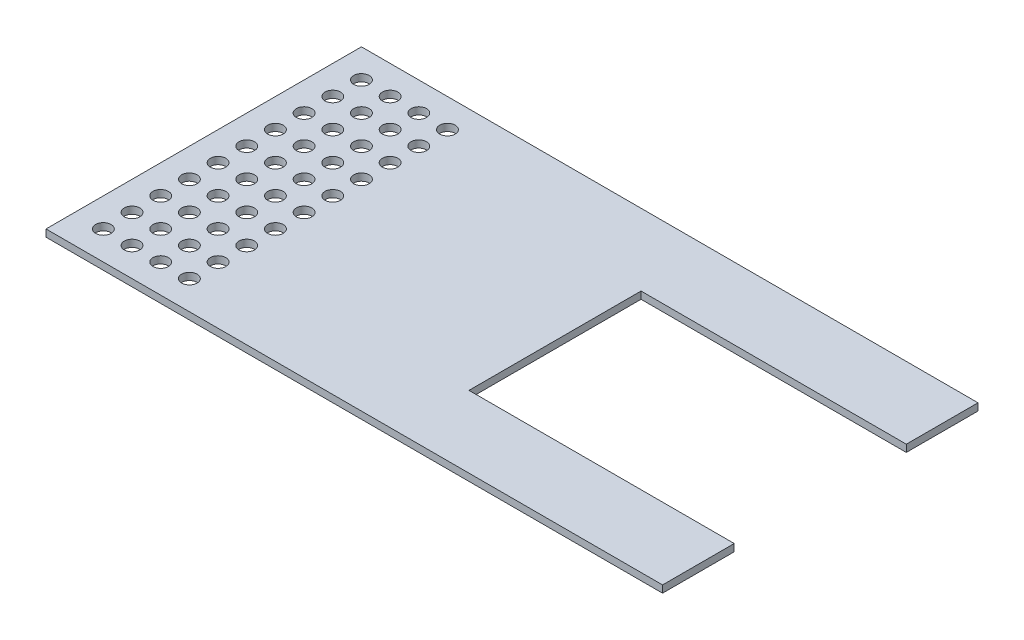
from build123d import *

# Parameters (mm, degrees)
SKETCH1_W           = 203.2
SKETCH1_H           = 133.35
BOSS_EXTRUDE1_DEPTH = 3.175
SKETCH3_W           = 35.687
SKETCH3_H           = 3.175
BOSS_EXTRUDE2_DEPTH = 3.175
SKETCH4_W           = 3.175
SKETCH4_H           = 18.542
BOSS_EXTRUDE3_DEPTH = 3.175
SKETCH5_R           = 3.429
BOSS_EXTRUDE4_DEPTH = 3.175
SKETCH8_W           = 127
SKETCH8_H           = 76.2
CUT_EXTRUDE4_DEPTH  = 183.223979624


with BuildPart() as part:
    # Sketch1 → Boss-Extrude1 (new body)
    with BuildSketch(Plane(origin=(0, 0, 0), x_dir=(1, 0, 0), z_dir=(0, 1, 0))):
        Rectangle(SKETCH1_W, SKETCH1_H)
    extrude(amount=BOSS_EXTRUDE1_DEPTH)

    # Sketch3 → Boss-Extrude2 (add)
    with BuildSketch(Plane(origin=(0, 3.175, 0), x_dir=(1, 0, 0), z_dir=(0, 1, 0))):
        with Locations((-61.2775, 68.2625)):
            Rectangle(SKETCH3_W, SKETCH3_H)
        with Locations((0.3175, 68.2625)):
            Rectangle(SKETCH3_W, SKETCH3_H)
        with Locations((61.9125, 68.2625)):
            Rectangle(SKETCH3_W, SKETCH3_H)
        with Locations((61.9125, -68.2625)):
            Rectangle(SKETCH3_W, SKETCH3_H)
        with Locations((0.3175, -68.2625)):
            Rectangle(SKETCH3_W, SKETCH3_H)
        with Locations((-61.2775, -68.2625)):
            Rectangle(SKETCH3_W, SKETCH3_H)
    extrude(amount=-BOSS_EXTRUDE2_DEPTH)

    # Sketch4 → Boss-Extrude3 (add)
    with BuildSketch(Plane(origin=(0, 3.175, 0), x_dir=(1, 0, 0), z_dir=(0, 1, 0))):
        with Locations((-103.1875, 38.1)):
            Rectangle(SKETCH4_W, SKETCH4_H)
        with Locations((-103.1875, 0)):
            Rectangle(SKETCH4_W, SKETCH4_H)
        with Locations((-103.1875, -38.1)):
            Rectangle(SKETCH4_W, SKETCH4_H)
        with Locations((103.1875, -38.1)):
            Rectangle(SKETCH4_W, SKETCH4_H)
        with Locations((103.1875, 0)):
            Rectangle(SKETCH4_W, SKETCH4_H)
        with Locations((103.1875, 38.1)):
            Rectangle(SKETCH4_W, SKETCH4_H)
    extrude(amount=-BOSS_EXTRUDE3_DEPTH)

    # Sketch5 → Boss-Extrude4 (add)
    with BuildSketch(Plane(origin=(0, 3.175, 0), x_dir=(1, 0, 0), z_dir=(0, 1, 0))):
        Polygon((-104.775, 69.85), (-168.275, 69.85), (-168.275, -69.85), (-104.775, -69.85), (104.775, -69.85), (104.775, 69.85), align=None)
        with Locations(Location((-117.475, 57.15, 0), (0, 0, 270))):
            Circle(SKETCH5_R, mode=Mode.SUBTRACT)
        with Locations(Location((-130.175, 57.15, 0), (0, 0, 270))):
            Circle(SKETCH5_R, mode=Mode.SUBTRACT)
        with Locations(Location((-142.875, 57.15, 0), (0, 0, 270))):
            Circle(SKETCH5_R, mode=Mode.SUBTRACT)
        with Locations(Location((-155.575, 57.15, 0), (0, 0, 270))):
            Circle(SKETCH5_R, mode=Mode.SUBTRACT)
        with Locations(Location((-130.175, 44.45, 0), (0, 0, 270))):
            Circle(SKETCH5_R, mode=Mode.SUBTRACT)
        with Locations(Location((-142.875, 44.45, 0), (0, 0, 270))):
            Circle(SKETCH5_R, mode=Mode.SUBTRACT)
        with Locations(Location((-155.575, 44.45, 0), (0, 0, 270))):
            Circle(SKETCH5_R, mode=Mode.SUBTRACT)
        with Locations(Location((-130.175, 31.75, 0), (0, 0, 270))):
            Circle(SKETCH5_R, mode=Mode.SUBTRACT)
        with Locations(Location((-142.875, 31.75, 0), (0, 0, 270))):
            Circle(SKETCH5_R, mode=Mode.SUBTRACT)
        with Locations(Location((-155.575, 31.75, 0), (0, 0, 270))):
            Circle(SKETCH5_R, mode=Mode.SUBTRACT)
        with Locations(Location((-130.175, 19.05, 0), (0, 0, 270))):
            Circle(SKETCH5_R, mode=Mode.SUBTRACT)
        with Locations(Location((-142.875, 19.05, 0), (0, 0, 270))):
            Circle(SKETCH5_R, mode=Mode.SUBTRACT)
        with Locations(Location((-155.575, 19.05, 0), (0, 0, 270))):
            Circle(SKETCH5_R, mode=Mode.SUBTRACT)
        with Locations(Location((-130.175, 6.35, 0), (0, 0, 270))):
            Circle(SKETCH5_R, mode=Mode.SUBTRACT)
        with Locations(Location((-142.875, 6.35, 0), (0, 0, 270))):
            Circle(SKETCH5_R, mode=Mode.SUBTRACT)
        with Locations(Location((-155.575, 6.35, 0), (0, 0, 270))):
            Circle(SKETCH5_R, mode=Mode.SUBTRACT)
        with Locations(Location((-130.175, -6.35, 0), (0, 0, 270))):
            Circle(SKETCH5_R, mode=Mode.SUBTRACT)
        with Locations(Location((-142.875, -6.35, 0), (0, 0, 270))):
            Circle(SKETCH5_R, mode=Mode.SUBTRACT)
        with Locations(Location((-155.575, -6.35, 0), (0, 0, 270))):
            Circle(SKETCH5_R, mode=Mode.SUBTRACT)
        with Locations(Location((-130.175, -19.05, 0), (0, 0, 270))):
            Circle(SKETCH5_R, mode=Mode.SUBTRACT)
        with Locations(Location((-142.875, -19.05, 0), (0, 0, 270))):
            Circle(SKETCH5_R, mode=Mode.SUBTRACT)
        with Locations(Location((-155.575, -19.05, 0), (0, 0, 270))):
            Circle(SKETCH5_R, mode=Mode.SUBTRACT)
        with Locations(Location((-130.175, -31.75, 0), (0, 0, 270))):
            Circle(SKETCH5_R, mode=Mode.SUBTRACT)
        with Locations(Location((-142.875, -31.75, 0), (0, 0, 270))):
            Circle(SKETCH5_R, mode=Mode.SUBTRACT)
        with Locations(Location((-155.575, -31.75, 0), (0, 0, 270))):
            Circle(SKETCH5_R, mode=Mode.SUBTRACT)
        with Locations(Location((-130.175, -44.45, 0), (0, 0, 270))):
            Circle(SKETCH5_R, mode=Mode.SUBTRACT)
        with Locations(Location((-142.875, -44.45, 0), (0, 0, 270))):
            Circle(SKETCH5_R, mode=Mode.SUBTRACT)
        with Locations(Location((-155.575, -44.45, 0), (0, 0, 270))):
            Circle(SKETCH5_R, mode=Mode.SUBTRACT)
        with Locations(Location((-130.175, -57.15, 0), (0, 0, 270))):
            Circle(SKETCH5_R, mode=Mode.SUBTRACT)
        with Locations(Location((-142.875, -57.15, 0), (0, 0, 270))):
            Circle(SKETCH5_R, mode=Mode.SUBTRACT)
        with Locations(Location((-155.575, -57.15, 0), (0, 0, 270))):
            Circle(SKETCH5_R, mode=Mode.SUBTRACT)
        with Locations(Location((-117.475, 44.45, 0), (0, 0, 270))):
            Circle(SKETCH5_R, mode=Mode.SUBTRACT)
        with Locations(Location((-117.475, 31.75, 0), (0, 0, 270))):
            Circle(SKETCH5_R, mode=Mode.SUBTRACT)
        with Locations(Location((-117.475, 19.05, 0), (0, 0, 270))):
            Circle(SKETCH5_R, mode=Mode.SUBTRACT)
        with Locations(Location((-117.475, 6.35, 0), (0, 0, 270))):
            Circle(SKETCH5_R, mode=Mode.SUBTRACT)
        with Locations(Location((-117.475, -6.35, 0), (0, 0, 270))):
            Circle(SKETCH5_R, mode=Mode.SUBTRACT)
        with Locations(Location((-117.475, -19.05, 0), (0, 0, 270))):
            Circle(SKETCH5_R, mode=Mode.SUBTRACT)
        with Locations(Location((-117.475, -31.75, 0), (0, 0, 270))):
            Circle(SKETCH5_R, mode=Mode.SUBTRACT)
        with Locations(Location((-117.475, -44.45, 0), (0, 0, 270))):
            Circle(SKETCH5_R, mode=Mode.SUBTRACT)
        with Locations(Location((-117.475, -57.15, 0), (0, 0, 270))):
            Circle(SKETCH5_R, mode=Mode.SUBTRACT)
    extrude(amount=-BOSS_EXTRUDE4_DEPTH)

    # Sketch8 → Cut-Extrude4 (cut, through all)
    with BuildSketch(Plane(origin=(0, 0, 0), x_dir=(1, 0, 0), z_dir=(0, 1, 0))):
        with Locations((50.8, 0)):
            Rectangle(SKETCH8_W, SKETCH8_H)
    extrude(amount=CUT_EXTRUDE4_DEPTH, mode=Mode.SUBTRACT)


solid = part.part
